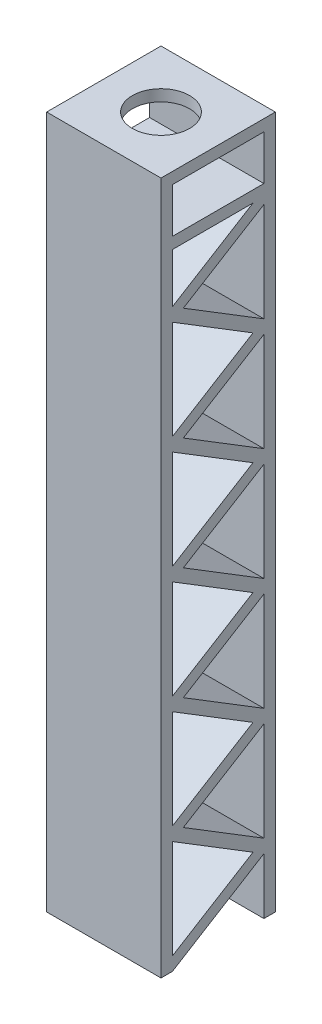
from build123d import *

# Parameters (mm, degrees)
SKETCH1_W           = 40
SKETCH1_H           = 19.58331309
BOSS_EXTRUDE1_DEPTH = 25
CUT_EXTRUDE1_REACH  = 306.991
SKETCH2_R           = 12.5


with BuildPart() as part:
    # Sketch1 → Boss-Extrude1 (new, symmetric)
    with BuildSketch(Plane(origin=(0, 0, 0), x_dir=(0, 0, -1), z_dir=(1, 0, 0))):
        Polygon((-25, -150), (-25, 150), (25, 150), (25, -150), (25, -152.934399054), (20, -152.934399054), (20, -150), (20, -128.351099054), (-18.690995821, -152.129907993), (-20, -152.934399054), (-25, -152.934399054), align=None)
        Polygon((15.225378118, 120.41668691), (-20, 120.41668691), (-20, 98.767785964), align=None, mode=Mode.SUBTRACT)
        Polygon((-20, -147.065600946), (-20, -103.767412144), (15.225406311, -125.416682672), align=None, mode=Mode.SUBTRACT)
        Polygon((-20, -97.898614036), (-20, -54.600812144), (15.225378116, -76.250065344), align=None, mode=Mode.SUBTRACT)
        with Locations((-3.9301e-05, 135.208343455)):
            Rectangle(SKETCH1_W, SKETCH1_H, mode=Mode.SUBTRACT)
        Polygon((20, -73.315687856), (20, -30.017885964), (-15.225378116, -51.666434656), align=None, mode=Mode.SUBTRACT)
        Polygon((15.225378116, 71.249734656), (-20, 92.898987856), (-20, 49.601185964), align=None, mode=Mode.SUBTRACT)
        Polygon((15.225378116, 22.083134656), (-20, 43.732387856), (-20, 0.434585964), align=None, mode=Mode.SUBTRACT)
        Polygon((15.225378116, -27.083465344), (-20, -5.434212144), (-20, -48.732014036), align=None, mode=Mode.SUBTRACT)
        Polygon((-15.225378116, 95.833365344), (20, 117.481914036), (20, 74.184112144), align=None, mode=Mode.SUBTRACT)
        Polygon((-15.225378116, 46.666765344), (20, 68.315314036), (20, 25.017512144), align=None, mode=Mode.SUBTRACT)
        Polygon((-15.225378116, -2.499834656), (20, 19.148714036), (20, -24.149087856), align=None, mode=Mode.SUBTRACT)
        Polygon((20, -79.184485964), (-15.225378116, -100.833034656), (20, -122.482287856), align=None, mode=Mode.SUBTRACT)
    extrude(amount=BOSS_EXTRUDE1_DEPTH, both=True)

    # Sketch2 → Cut-Extrude1 (cut, up to next)
    with BuildSketch(Plane(origin=(0, 150, 0), x_dir=(1, 0, 0), z_dir=(0, 1, 0)), mode=Mode.PRIVATE) as cut_extrude1_sk1:
        with Locations(Location((0, 0, 0), (0, 0, 270))):
            Circle(SKETCH2_R)
    cut_extrude1_tool1 = extrude(cut_extrude1_sk1.sketch, amount=-CUT_EXTRUDE1_REACH, mode=Mode.PRIVATE) & part.part
    add(cut_extrude1_tool1.solids().sort_by_distance((0, 150, 0))[0], mode=Mode.SUBTRACT)


solid = part.part
